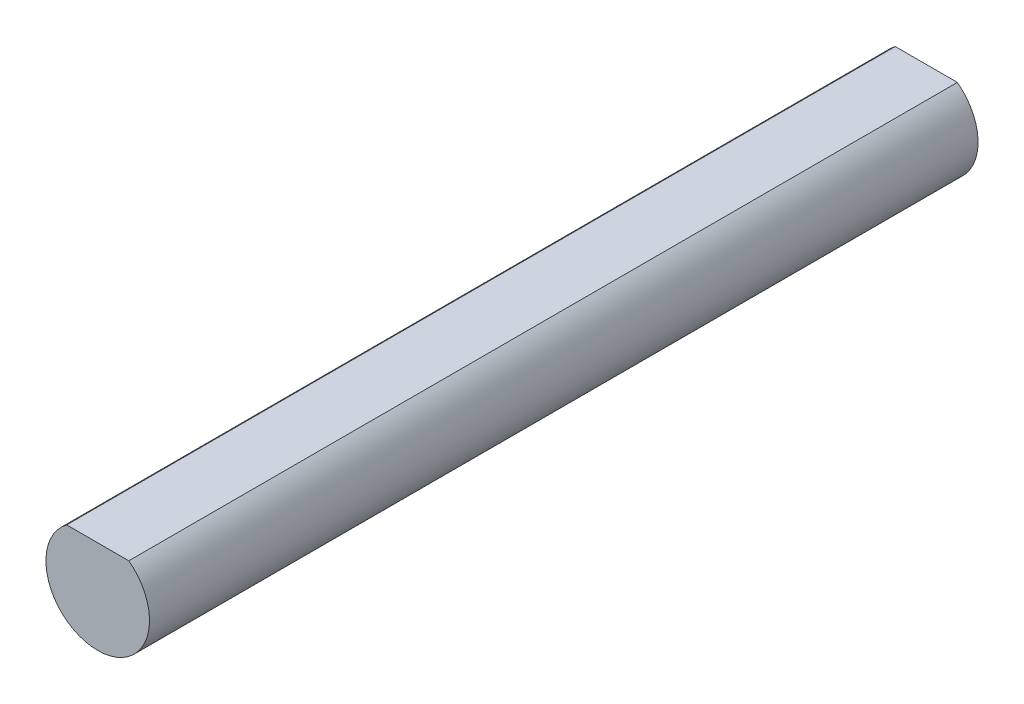
from build123d import *

# Parameters (mm, degrees)
BOSS_EXTRU_1_DEPTH = 50.8


with BuildPart() as part:
    # Esquisse2 → Boss.-Extru.1 (new body)
    with BuildSketch(Plane.XY):
        with BuildLine():
            Line((-1.905, 2.54), (1.905, 2.54))
            ThreePointArc((1.905, 2.54), (0, -3.175), (-1.905, 2.54))
        make_face()
    extrude(amount=BOSS_EXTRU_1_DEPTH)


solid = part.part
